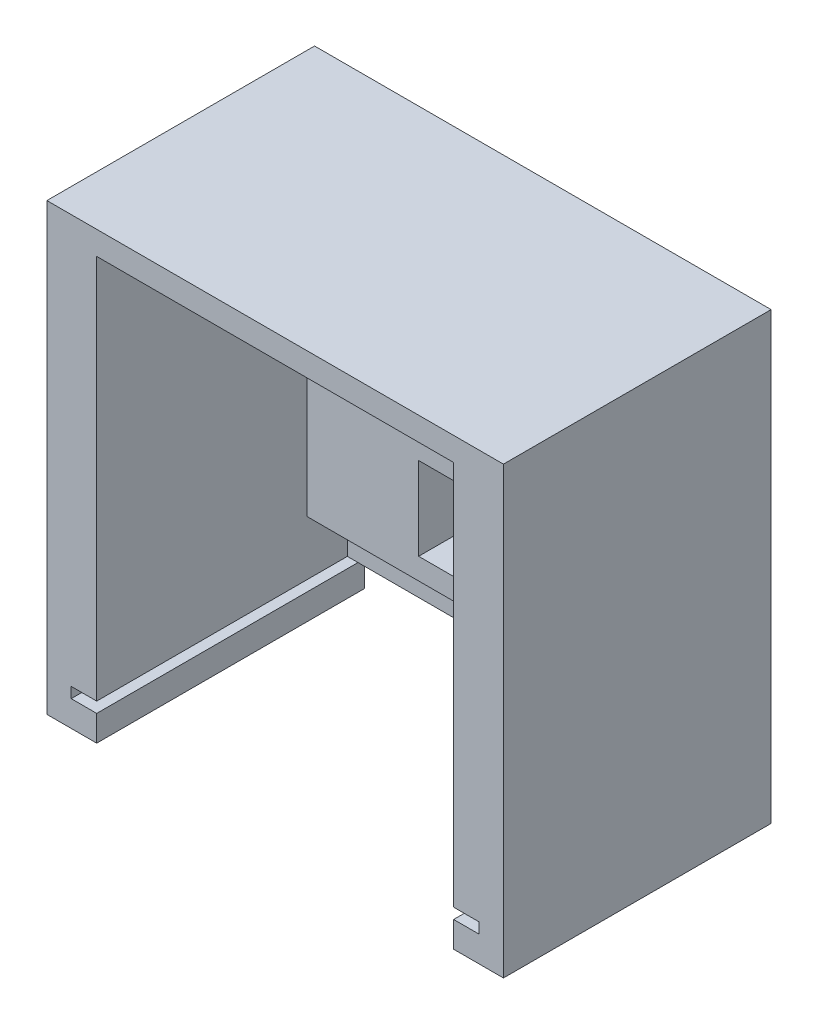
from build123d import *

# Parameters (mm, degrees)
BOSS_EXTRUDE1_DEPTH = 100
SKETCH2_W           = 133.34
SKETCH2_H           = 143.88
BOSS_EXTRUDE2_DEPTH = 6.35
SKETCH3_W           = 87.34
SKETCH3_H           = 56.97
BOSS_EXTRUDE3_DEPTH = 15
SKETCH4_R           = 4.5
CUT_EXTRUDE1_DEPTH  = 256.936366505
SKETCH5_W           = 40
SKETCH5_H           = 31
CUT_EXTRUDE2_DEPTH  = 251.836448109
CUT_EXTRUDE3_DEPTH  = 2.545
SKETCH7_W           = 8.71
SKETCH7_H           = 8.71
CUT_EXTRUDE4_DEPTH  = 257.878530097


with BuildPart() as part:
    # Sketch1 → Boss-Extrude1 (new body)
    with BuildSketch(Plane.XY):
        Polygon((0, 0), (0, 166.26), (-170.56, 166.26), (-170.56, 0), (-151.95, 0), (-151.95, 9.64), (-161.48, 9.64), (-161.48, 13.61), (-151.95, 13.61), (-151.95, 157.49), (-18.61, 157.49), (-18.61, 13.61), (-9.08, 13.61), (-9.08, 9.64), (-18.61, 9.64), (-18.61, 0), align=None)
    extrude(amount=BOSS_EXTRUDE1_DEPTH)

    # Sketch2 → Boss-Extrude2 (add)
    with BuildSketch(Plane(origin=(0, 0, 0), x_dir=(-1, 0, 0), z_dir=(0, 0, -1))):
        with Locations((85.28, 85.55)):
            Rectangle(SKETCH2_W, SKETCH2_H)
    extrude(amount=-BOSS_EXTRUDE2_DEPTH)

    # Sketch3 → Boss-Extrude3 (add)
    with BuildSketch(Plane.XY.offset(6.35)):
        with Locations((-108.28, 62.455)):
            Rectangle(SKETCH3_W, SKETCH3_H)
    extrude(amount=BOSS_EXTRUDE3_DEPTH)

    # Sketch4 → Cut-Extrude1 (cut, through all)
    with BuildSketch(Plane.XY.offset(6.35)):
        with Locations((-56.502483378, 39.035418079)):
            Circle(SKETCH4_R)
        with Locations((-144.227493726, 97.982911805)):
            Circle(SKETCH4_R)
    extrude(amount=-CUT_EXTRUDE1_DEPTH, mode=Mode.SUBTRACT)

    # Sketch5 → Cut-Extrude2 (cut, through all)
    with BuildSketch(Plane.XY.offset(21.35)):
        with Locations((-90.33, 57.45)):
            Rectangle(SKETCH5_W, SKETCH5_H)
    extrude(amount=-CUT_EXTRUDE2_DEPTH, mode=Mode.SUBTRACT)

    # Sketch6 → Cut-Extrude3 (cut)
    with BuildSketch(Plane.XY.offset(6.35)):
        Polygon((-77.52, 157.49), (-77.52, 135.02), (-72.88, 135.02), (-72.88, 107.08), (-98.28, 107.08), (-98.28, 135.02), (-93.64, 135.02), (-93.64, 157.49), align=None)
    extrude(amount=-CUT_EXTRUDE3_DEPTH, mode=Mode.SUBTRACT)

    # Sketch7 → Cut-Extrude4 (cut, through all)
    with BuildSketch(Plane.XY.offset(3.805)):
        with Locations((-85.575, 122.315)):
            Rectangle(SKETCH7_W, SKETCH7_H)
    extrude(amount=-CUT_EXTRUDE4_DEPTH, mode=Mode.SUBTRACT)


solid = part.part
